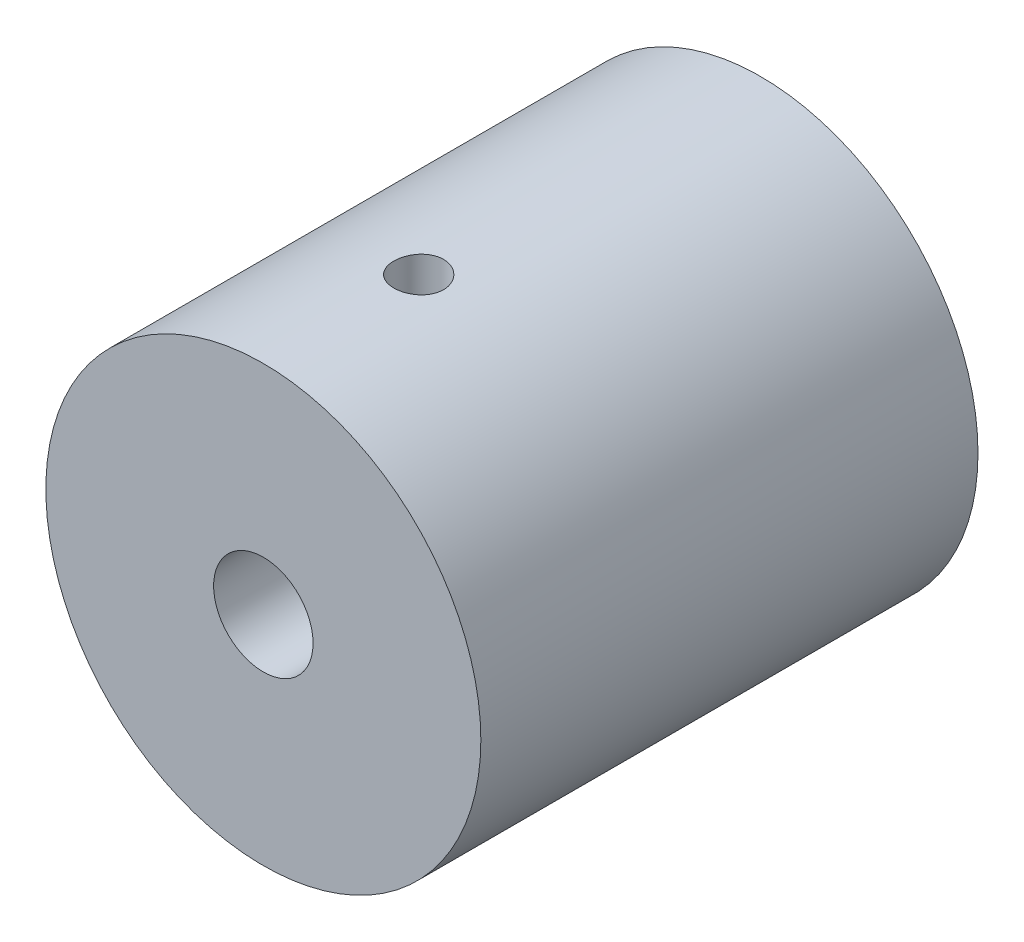
from build123d import *

# Parameters (mm, degrees)
CROQUIS1_R              = 17.5
CROQUIS1_R_2            = 13
SALIENTE_EXTRUIR1_DEPTH = 10
CROQUIS2_R              = 17.5
SALIENTE_EXTRUIR2_DEPTH = 30
CROQUIS12_R             = 4
CORTAR_EXTRUIR1_DEPTH   = 48.037219306
CROQUIS13_R             = 1
CORTAR_EXTRUIR2_DEPTH   = 10
CROQUIS14_R             = 2
CORTAR_EXTRUIR3_DEPTH   = 48.037219306


with BuildPart() as part:
    # Croquis1 → Saliente-Extruir1 (new body)
    with BuildSketch(Plane.XY):
        Circle(CROQUIS1_R)
        Circle(CROQUIS1_R_2, mode=Mode.SUBTRACT)
    extrude(amount=SALIENTE_EXTRUIR1_DEPTH)

    # Croquis2 → Saliente-Extruir2 (add)
    with BuildSketch(Plane.XY.offset(10)):
        Circle(CROQUIS2_R)
    extrude(amount=SALIENTE_EXTRUIR2_DEPTH)

    # Croquis4 → Cortar-Revolución1 (revolve, cut)
    with BuildSketch(Plane(origin=(0, 0, 0), x_dir=(0, 0, -1), z_dir=(1, 0, 0)), mode=Mode.PRIVATE) as cortar_revoluci_n1_sk:
        Polygon((-10, 0), (-10, 13), (-15, 0), align=None)
    revolve(cortar_revoluci_n1_sk.sketch.rotate(Axis((0, 0, 40), (0, 0, -1)), 270), axis=Axis((0, 0, 40), (0, 0, -1)), mode=Mode.SUBTRACT)

    # Croquis12 → Cortar-Extruir1 (cut, through all)
    with BuildSketch(Plane.XY.offset(40)):
        Circle(CROQUIS12_R)
    extrude(amount=-CORTAR_EXTRUIR1_DEPTH, mode=Mode.SUBTRACT)

    # Croquis13 → Cortar-Extruir2 (cut)
    with BuildSketch(Plane(origin=(0, 0, 0), x_dir=(-1, 0, 0), z_dir=(0, 0, -1))):
        with Locations((-15.25, 0)):
            Circle(CROQUIS13_R)
        with Locations((15.25, 0)):
            Circle(CROQUIS13_R)
    extrude(amount=-CORTAR_EXTRUIR2_DEPTH, mode=Mode.SUBTRACT)

    # Croquis14 → Cortar-Extruir3 (cut, through all)
    with BuildSketch(Plane(origin=(0, 0, 0), x_dir=(1, 0, 0), z_dir=(0, 1, 0))):
        with Locations(Location((0, -27.5, 0), (0, 0, 90))):
            Circle(CROQUIS14_R)
    extrude(amount=CORTAR_EXTRUIR3_DEPTH, mode=Mode.SUBTRACT)


solid = part.part
